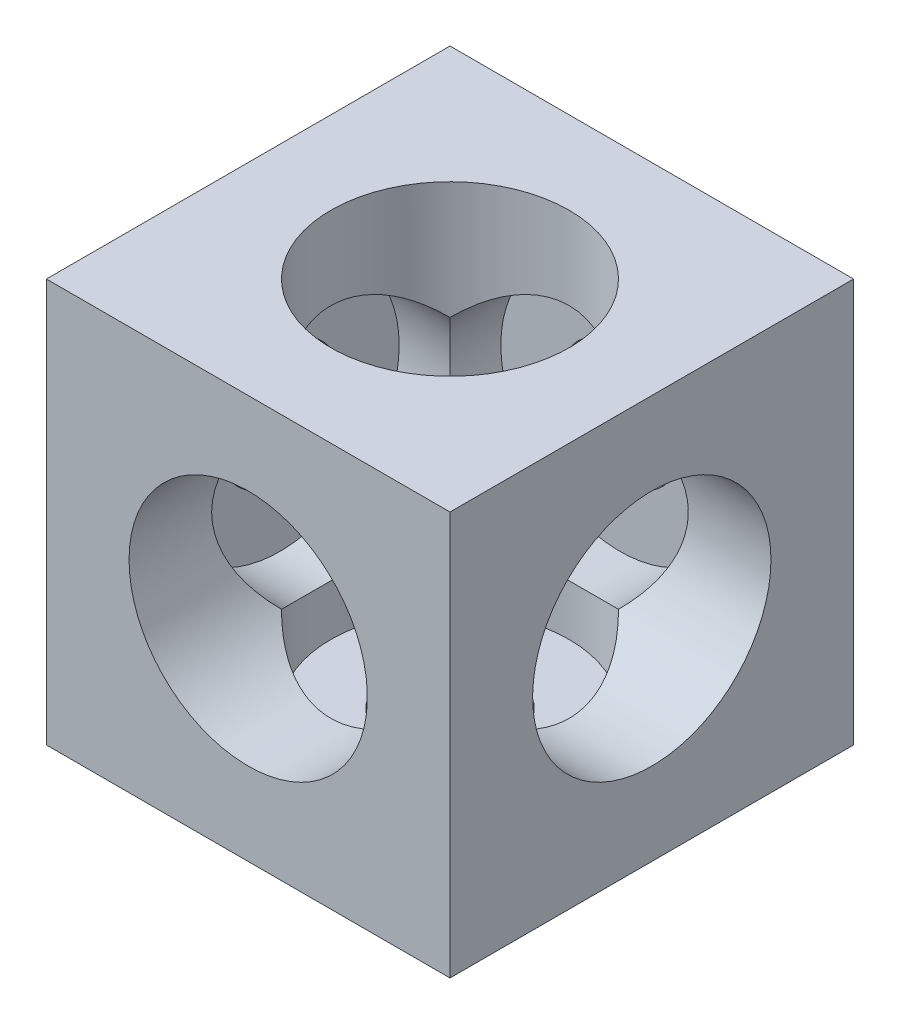
from build123d import *

# Parameters (mm, degrees)
SKETCH1_W           = 25.4
SKETCH1_H           = 25.4
BOSS_EXTRUDE1_DEPTH = 25.4
CUT_EXTRUDE1_START  = -2
SKETCH2_R           = 7.5
CUT_EXTRUDE1_DEPTH  = 42.994090512
CUT_EXTRUDE3_START  = -2
SKETCH4_R           = 7.5
CUT_EXTRUDE3_DEPTH  = 42.994090512
SKETCH5_R           = 3.75
CUT_EXTRUDE4_DEPTH  = 43.87050268
SKETCH7_R           = 3.75
CUT_EXTRUDE6_DEPTH  = 43.87050268
SKETCH6_R           = 3.75
CUT_EXTRUDE7_DEPTH  = 10
CUT_EXTRUDE8_START  = 2
SKETCH3_R           = 7.5
CUT_EXTRUDE8_DEPTH  = 42.994090628


with BuildPart() as part:
    # Sketch1 → Boss-Extrude1 (new body)
    with BuildSketch(Plane.XY):
        with Locations((12.7, 12.7)):
            Rectangle(SKETCH1_W, SKETCH1_H)
    extrude(amount=BOSS_EXTRUDE1_DEPTH)

    # Sketch2 → Cut-Extrude1 (cut, through all)
    with BuildSketch(Plane(origin=(0, 0, 0), x_dir=(-1, 0, 0), z_dir=(0, 0, -1)).offset(CUT_EXTRUDE1_START)):
        with Locations((-12.7, 12.7)):
            Circle(SKETCH2_R)
    extrude(amount=-CUT_EXTRUDE1_DEPTH, mode=Mode.SUBTRACT)

    # Sketch4 → Cut-Extrude3 (cut, through all)
    with BuildSketch(Plane.XZ.offset(CUT_EXTRUDE3_START)):
        with Locations(Location((12.7, 12.7, 0), (0, 0, 270))):
            Circle(SKETCH4_R)
    extrude(amount=-CUT_EXTRUDE3_DEPTH, mode=Mode.SUBTRACT)

    # Sketch5 → Cut-Extrude4 (cut, through all)
    with BuildSketch(Plane(origin=(0, 2, 0), x_dir=(1, 0, 0), z_dir=(0, 1, 0))):
        with Locations(Location((12.7, -12.7, 0), (0, 0, 270))):
            Circle(SKETCH5_R)
    extrude(amount=-CUT_EXTRUDE4_DEPTH, mode=Mode.SUBTRACT)

    # Sketch7 → Cut-Extrude6 (cut, through all)
    with BuildSketch(Plane.XY.offset(2)):
        with Locations((12.7, 12.7)):
            Circle(SKETCH7_R)
    extrude(amount=-CUT_EXTRUDE6_DEPTH, mode=Mode.SUBTRACT)

    # Sketch6 → Cut-Extrude7 (cut)
    with BuildSketch(Plane.ZY):
        with Locations((12.7, 12.7)):
            Circle(SKETCH6_R)
    extrude(amount=-CUT_EXTRUDE7_DEPTH, mode=Mode.SUBTRACT)

    # Sketch3 → Cut-Extrude8 (cut, through all)
    with BuildSketch(Plane(origin=(0, 0, 0), x_dir=(0, 0, -1), z_dir=(1, 0, 0)).offset(CUT_EXTRUDE8_START)):
        with Locations((-12.7, 12.7)):
            Circle(SKETCH3_R)
    extrude(amount=CUT_EXTRUDE8_DEPTH, mode=Mode.SUBTRACT)


solid = part.part
